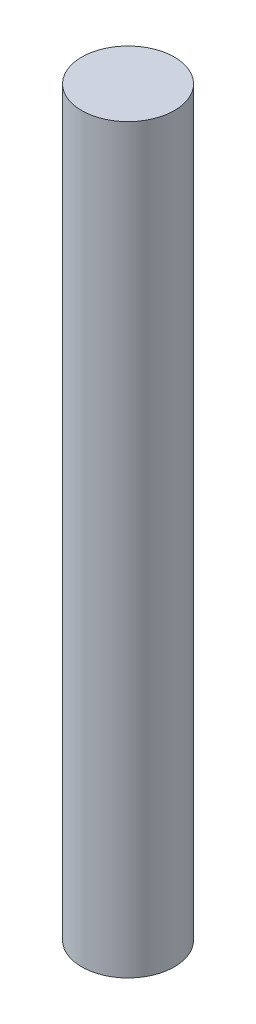
from build123d import *

# Parameters (mm, degrees)
SKETCH1_R           = 1.5875
BOSS_EXTRUDE1_DEPTH = 25.4


with BuildPart() as part:
    # Sketch1 → Boss-Extrude1 (new body)
    with BuildSketch(Plane(origin=(0, 0, 0), x_dir=(1, 0, 0), z_dir=(0, 1, 0))):
        with Locations(Location((0, 0, 0), (0, 0, 90))):
            Circle(SKETCH1_R)
    extrude(amount=BOSS_EXTRUDE1_DEPTH)


solid = part.part
